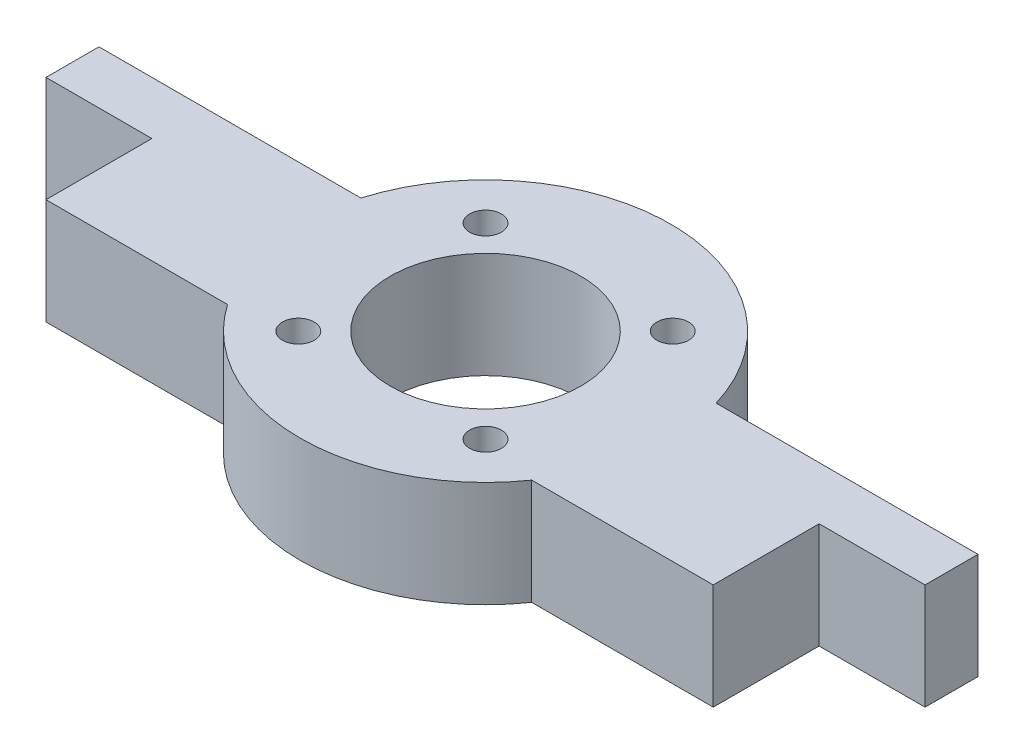
from build123d import *

# Parameters (mm, degrees)
SKETCH_1_R      = 9
SKETCH_1_R_2    = 1.5
EXTRUDE_1_DEPTH = 10


with BuildPart() as part:
    # Эскиз1 → Бобышка-Вытянуть1 (new body)
    with BuildSketch(Plane(origin=(0, 0, 0), x_dir=(1, 0, 0), z_dir=(0, 1, 0))):
        with BuildLine():
            Line((-31.5, 0), (-31.5, -10))
            Line((-31.5, -10), (-14.361406616, -10))
            ThreePointArc((-14.361406616, -10), (0, -17.5), (14.361406616, -10))
            Line((14.361406616, -10), (31.5, -10))
            Line((31.5, -10), (31.5, 0))
            Line((31.5, 0), (41.5, 0))
            Line((41.5, 0), (41.5, 5))
            Line((41.5, 5), (16.770509831, 5))
            ThreePointArc((16.770509831, 5), (0, 17.5), (-16.770509831, 5))
            Line((-16.770509831, 5), (-41.5, 5))
            Line((-41.5, 5), (-41.5, 0))
            Line((-41.5, 0), (-31.5, 0))
        make_face()
        with Locations(Location((0, 0, 0), (0, 0, 270))):
            Circle(SKETCH_1_R, mode=Mode.SUBTRACT)
        with Locations(Location((-8.838834765, 8.838834765, 0), (0, 0, 270))):
            Circle(SKETCH_1_R_2, mode=Mode.SUBTRACT)
        with Locations(Location((8.838834765, 8.838834765, 0), (0, 0, 270))):
            Circle(SKETCH_1_R_2, mode=Mode.SUBTRACT)
        with Locations(Location((8.838834765, -8.838834765, 0), (0, 0, 270))):
            Circle(SKETCH_1_R_2, mode=Mode.SUBTRACT)
        with Locations(Location((-8.838834765, -8.838834765, 0), (0, 0, 270))):
            Circle(SKETCH_1_R_2, mode=Mode.SUBTRACT)
    extrude(amount=EXTRUDE_1_DEPTH)


solid = part.part
